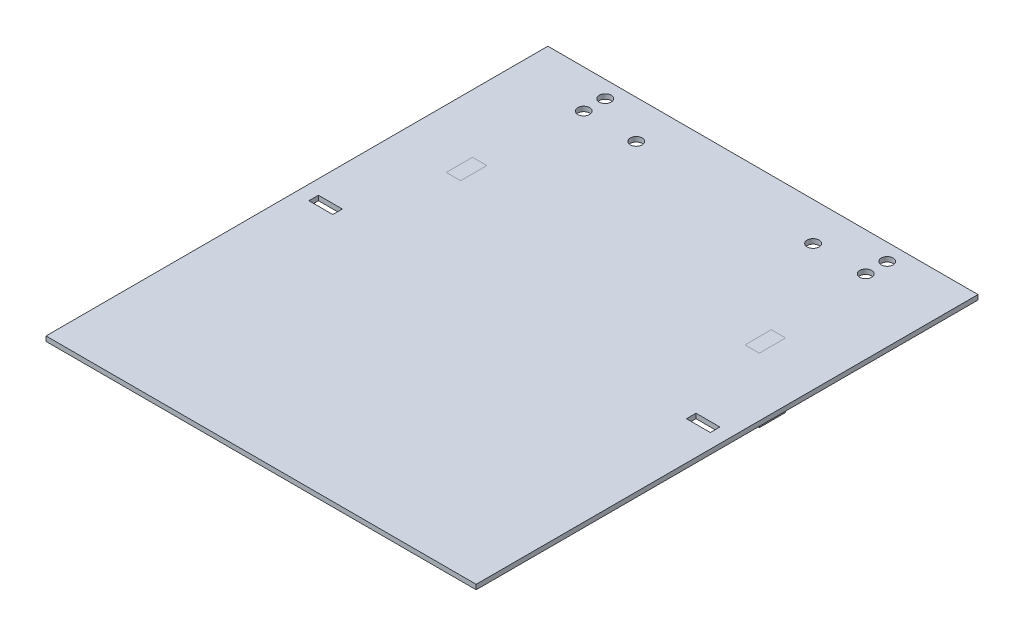
from build123d import *

# Parameters (mm, degrees)
SKETCH1_W              = 180
SKETCH1_H              = 210
SKETCH1_R              = 2.5
SKETCH1_W_2            = 10
SKETCH1_H_2            = 4
SKETCH1_W_3            = 6
SKETCH1_H_3            = 11
MAINBODY_DEPTH         = 2
SAYAPRODA_DEPTH        = 2
SAYAPRODA_DEPTH_BACK   = 25
SKETCH1_4_W            = 6
SKETCH1_4_H            = 11
SAYAPRODA_2_DEPTH      = 2
SAYAPRODA_2_DEPTH_BACK = 25
SKETCH9_W              = 1.5
SKETCH9_H              = 155.5
HOLE1_AT_2_COUNT       = 2
HOLE1_AT_2_PITCH       = 11
HOLE1_AT_3_COUNT       = 2
HOLE1_AT_3_PITCH       = 12.504350098
HOLE1_AT_4_COUNT       = 2
HOLE1_AT_4_PITCH       = 13.992231398
HOLE1_AT_5_COUNT       = 2
HOLE1_AT_5_PITCH       = 15.354775431


with BuildPart() as part:
    # Sketch1 → MainBody (new body)
    with BuildSketch(Plane(origin=(0, 0, 0), x_dir=(1, 0, 0), z_dir=(0, 1, 0))):
        Rectangle(SKETCH1_W, SKETCH1_H)
        with Locations((-59, 98)):
            Circle(SKETCH1_R, mode=Mode.SUBTRACT)
        with Locations((-59, 89)):
            Circle(SKETCH1_R, mode=Mode.SUBTRACT)
        with Locations((-37, 89)):
            Circle(SKETCH1_R, mode=Mode.SUBTRACT)
        with Locations((59, 98)):
            Circle(SKETCH1_R, mode=Mode.SUBTRACT)
        with Locations((59, 89)):
            Circle(SKETCH1_R, mode=Mode.SUBTRACT)
        with Locations((37, 89)):
            Circle(SKETCH1_R, mode=Mode.SUBTRACT)
        with Locations((79, 1)):
            Rectangle(SKETCH1_W_2, SKETCH1_H_2, mode=Mode.SUBTRACT)
        with Locations((-79, 1)):
            Rectangle(SKETCH1_W_2, SKETCH1_H_2, mode=Mode.SUBTRACT)
        with Locations((-62.5, 43.5)):
            Rectangle(SKETCH1_W_3, SKETCH1_H_3, mode=Mode.SUBTRACT)
        with Locations((62.5, 43.5)):
            Rectangle(SKETCH1_W_3, SKETCH1_H_3, mode=Mode.SUBTRACT)
    extrude(amount=MAINBODY_DEPTH)


with BuildPart() as body_2:
    # Sketch1<4> → SayapRoda (new, two sides: drawn at the far end of the back side and taken through both)
    with BuildSketch(Plane(origin=(0, 0, 0), x_dir=(1, 0, 0), z_dir=(0, 1, 0)).offset(-SAYAPRODA_DEPTH_BACK)):
        with Locations((-62.5, 43.5)):
            Rectangle(SKETCH1_4_W, SKETCH1_4_H)
    extrude(amount=SAYAPRODA_DEPTH + SAYAPRODA_DEPTH_BACK)


with BuildPart() as body_3:
    # Sketch1<4> → SayapRoda 2 (new, two sides: drawn at the far end of the back side and taken through both)
    with BuildSketch(Plane(origin=(0, 0, 0), x_dir=(1, 0, 0), z_dir=(0, 1, 0)).offset(-SAYAPRODA_2_DEPTH_BACK)):
        with Locations((62.5, 43.5)):
            Rectangle(SKETCH1_4_W, SKETCH1_4_H)
    extrude(amount=SAYAPRODA_2_DEPTH + SAYAPRODA_2_DEPTH_BACK)


with BuildPart() as hole1_tool:
    # Sketch9 → Hole1 (revolve)
    with BuildSketch(Plane(origin=(65.5, -20.233052412, -43.5), x_dir=(0, 0, -1), z_dir=(0, 1, 0))):
        with Locations((0.75, 77.75)):
            Rectangle(SKETCH9_W, SKETCH9_H)
    hole1 = revolve(axis=Axis((-44.5, -20.233052412, -43.5), (1, 0, 0)))


with BuildPart() as body_2_1:
    add(body_2.part)

    # Hole1: cut by hole1_tool
    add(hole1_tool.part, mode=Mode.SUBTRACT)


with BuildPart() as body_3_1:
    add(body_3.part)

    # Hole1: cut by hole1_tool
    add(hole1_tool.part, mode=Mode.SUBTRACT)


with BuildPart() as hole1_at_2_tool:
    # Hole1 at 2: Hole1 ×2
    with Locations(*[Vector(0, 0.9999876242984519, 0.004975062807454704) * (i * HOLE1_AT_2_PITCH) for i in range(1, HOLE1_AT_2_COUNT)]):
        add(hole1)


with BuildPart() as body_2_2:
    add(body_2_1.part)

    # Hole1 at 2: cut by hole1_at_2_tool
    add(hole1_at_2_tool.part, mode=Mode.SUBTRACT)


with BuildPart() as body_3_2:
    add(body_3_1.part)

    # Hole1 at 2: cut by hole1_at_2_tool
    add(hole1_at_2_tool.part, mode=Mode.SUBTRACT)


with BuildPart() as hole1_at_3_tool:
    # Hole1 at 3: Hole1 ×2
    with Locations(*[(0, i * HOLE1_AT_3_PITCH, 0) for i in range(1, HOLE1_AT_3_COUNT)]):
        add(hole1)


with BuildPart() as body_2_3:
    add(body_2_2.part)

    # Hole1 at 3: cut by hole1_at_3_tool
    add(hole1_at_3_tool.part, mode=Mode.SUBTRACT)


with BuildPart() as body_3_3:
    add(body_3_2.part)

    # Hole1 at 3: cut by hole1_at_3_tool
    add(hole1_at_3_tool.part, mode=Mode.SUBTRACT)


with BuildPart() as hole1_at_4_tool:
    # Hole1 at 4: Hole1 ×2
    with Locations(*[(0, i * HOLE1_AT_4_PITCH, 0) for i in range(1, HOLE1_AT_4_COUNT)]):
        add(hole1)


with BuildPart() as body_2_4:
    add(body_2_3.part)

    # Hole1 at 4: cut by hole1_at_4_tool
    add(hole1_at_4_tool.part, mode=Mode.SUBTRACT)


with BuildPart() as body_3_4:
    add(body_3_3.part)

    # Hole1 at 4: cut by hole1_at_4_tool
    add(hole1_at_4_tool.part, mode=Mode.SUBTRACT)


with BuildPart() as hole1_at_5_tool:
    # Hole1 at 5: Hole1 ×2
    with Locations(*[(0, i * HOLE1_AT_5_PITCH, 0) for i in range(1, HOLE1_AT_5_COUNT)]):
        add(hole1)


with BuildPart() as body_2_5:
    add(body_2_4.part)

    # Hole1 at 5: cut by hole1_at_5_tool
    add(hole1_at_5_tool.part, mode=Mode.SUBTRACT)


with BuildPart() as body_3_5:
    add(body_3_4.part)

    # Hole1 at 5: cut by hole1_at_5_tool
    add(hole1_at_5_tool.part, mode=Mode.SUBTRACT)


solid = Compound([part.part, body_2_5.part, body_3_5.part])
